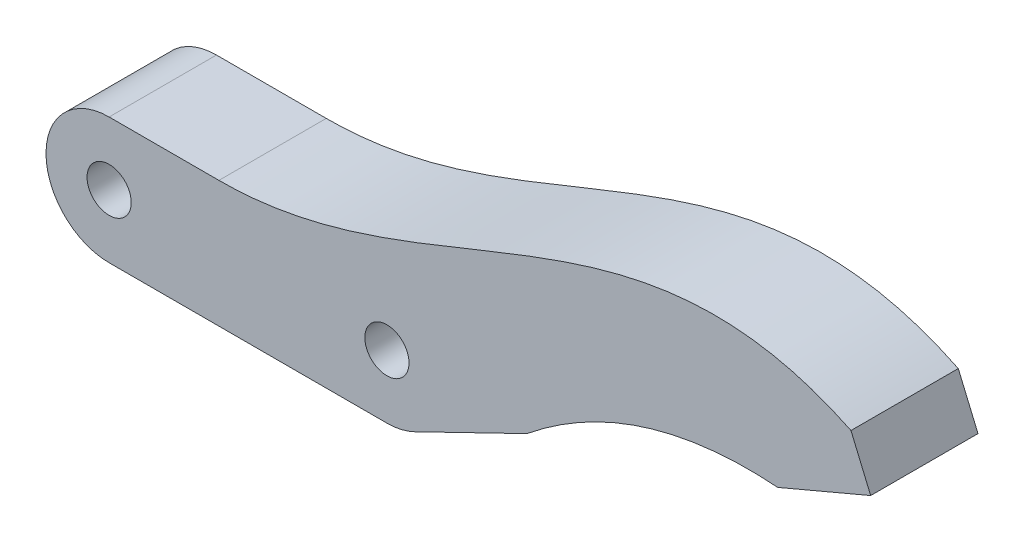
from build123d import *

# Parameters (mm, degrees)
SKETCH1_R           = 5
SKETCH1_R_2         = 1.75
BOSS_EXTRUDE1_DEPTH = 4.25
BOSS_EXTRUDE2_DEPTH = 8.5


with BuildPart() as part:
    # Sketch1 → Boss-Extrude1 (new, symmetric)
    # profile 1 of 3: a face of its own
    with BuildSketch(Plane.XY):
        with Locations((5, 5)):
            Circle(SKETCH1_R)
        with Locations((5, 5)):
            Circle(SKETCH1_R_2, mode=Mode.SUBTRACT)
    # profile 2 of 3: a face of its own
    with BuildSketch(Plane.XY):
        with BuildLine():
            ThreePointArc((10, 5), (8.535533906, 1.464466094), (5, 0))
            Line((5, 0), (27, 0))
            ThreePointArc((27, 0), (22, 5), (27, 10))
            Line((27, 10), (5, 10))
            ThreePointArc((5, 10), (8.535533906, 8.535533906), (10, 5))
        make_face()
    # profile 3 of 3: a face of its own
    with BuildSketch(Plane.XY):
        with Locations((27, 5)):
            Circle(SKETCH1_R)
        with Locations((27, 5)):
            Circle(SKETCH1_R_2, mode=Mode.SUBTRACT)
    extrude(amount=BOSS_EXTRUDE1_DEPTH, both=True)

    # Sketch2 → Boss-Extrude2 (add)
    with BuildSketch(Plane.XY.offset(4.25)):
        with BuildLine():
            ThreePointArc((27, 10), (31.87285141, 6.120410255), (29.183837077, 0.502127656))
            Line((29.183837077, 0.502127656), (38.085420661, 4.824084077))
            add(Edge.make_bspline(
                [(38.085420661, 4.824084077), (46.797509511, 11.895222457), (57.94800041, 11.067843667)],
                knots=[0, 0, 0, 1, 1, 1], degree=2))
            Line((57.94800041, 11.067843667), (65.313809692, 14.189518476))
            Line((65.313809692, 14.189518476), (63.752972288, 17.872423117))
            add(Edge.make_bspline(
                [(63.752972288, 17.872423117), (45.928882679, 26.563787963), (31.059268622, 10), (13.69497476, 10)],
                knots=[0, 0, 0, 0, 1, 1, 1, 1], degree=3))
            Line((13.69497476, 10), (27, 10))
        make_face()
    extrude(amount=-BOSS_EXTRUDE2_DEPTH)


solid = part.part
